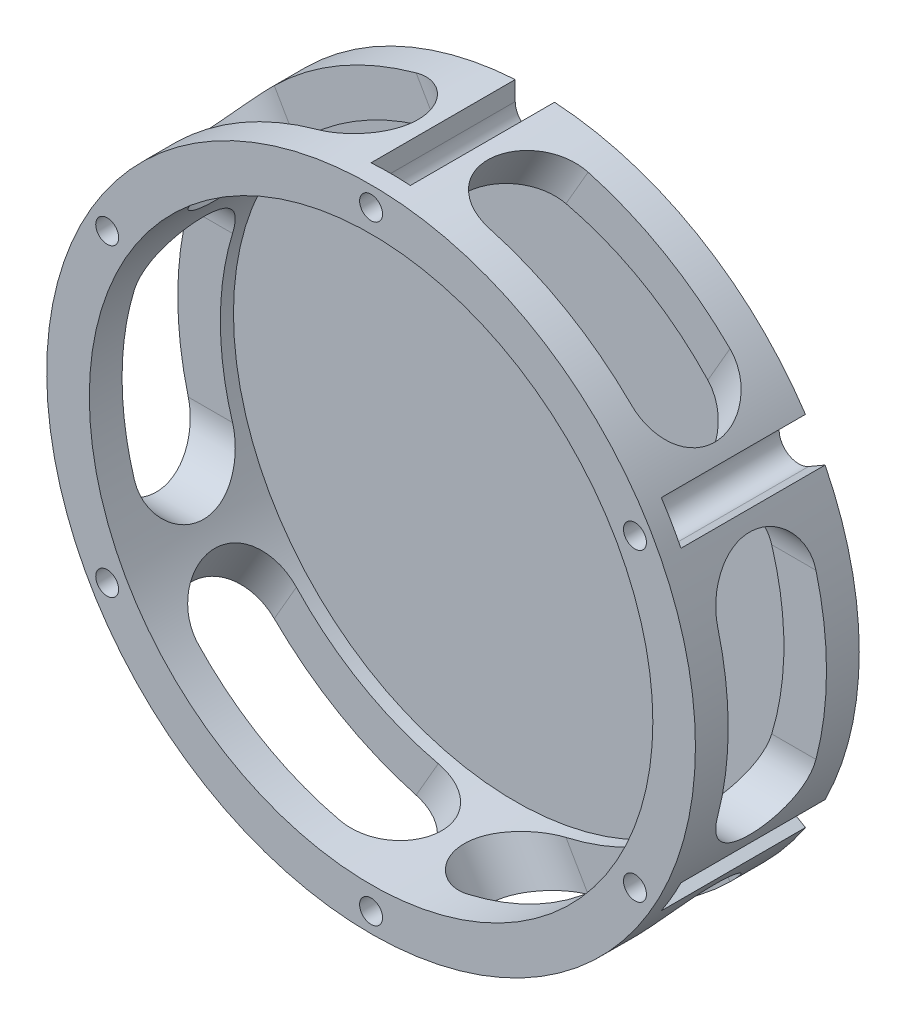
from build123d import *

# Parameters (mm, degrees)
SKETCH_1_R               = 49.5
SKETCH_1_R_2             = 43
SKETCH_1_R_3             = 1.75
EXTRUDE_1_DEPTH          = 25
CUT_EXTRUDE_1_DEPTH      = 59
PATTERN_CIRCULAR_1_COUNT = 6
SKETCH_3_R               = 44.045845484
EXTRUDE_2_DEPTH          = 3
CUT_EXTRUDE_3_DEPTH      = 22


with BuildPart() as part:
    # Эскиз1 → Бобышка-Вытянуть1 (new body)
    with BuildSketch(Plane.XY):
        Circle(SKETCH_1_R)
        Circle(SKETCH_1_R_2, mode=Mode.SUBTRACT)
        with Locations((0, 46.5)):
            Circle(SKETCH_1_R_3, mode=Mode.SUBTRACT)
        with Locations((40.270181276, 23.25)):
            Circle(SKETCH_1_R_3, mode=Mode.SUBTRACT)
        with Locations((40.270181276, -23.25)):
            Circle(SKETCH_1_R_3, mode=Mode.SUBTRACT)
        with Locations((0, -46.5)):
            Circle(SKETCH_1_R_3, mode=Mode.SUBTRACT)
        with Locations((-40.270181276, -23.25)):
            Circle(SKETCH_1_R_3, mode=Mode.SUBTRACT)
        with Locations((-40.270181276, 23.25)):
            Circle(SKETCH_1_R_3, mode=Mode.SUBTRACT)
    extrude(amount=EXTRUDE_1_DEPTH)

    # Эскиз2 → Вырез-Вытянуть1 (cut)
    with BuildSketch(Plane(origin=(0, 0, 0), x_dir=(0, 0, -1), z_dir=(1, 0, 0))):
        with BuildLine():
            Line((-5, 12.5), (-5, -12.5))
            ThreePointArc((-5, -12.5), (-12.5, -20), (-20, -12.5))
            Line((-20, -12.5), (-20, 12.5))
            ThreePointArc((-20, 12.5), (-12.5, 20), (-5, 12.5))
        make_face()
    cut_extrude_1 = extrude(amount=-CUT_EXTRUDE_1_DEPTH, mode=Mode.SUBTRACT)

    # Круговой массив1: Вырез-Вытянуть1 ×6 about axis
    pattern_circular_1_axis = Axis((0, 0, 25), (0, 0, -1))
    for i in range(1, PATTERN_CIRCULAR_1_COUNT):
        add(cut_extrude_1.rotate(pattern_circular_1_axis, i * 360 / PATTERN_CIRCULAR_1_COUNT), mode=Mode.SUBTRACT)

    # Эскиз3 → Бобышка-Вытянуть2 (add)
    with BuildSketch(Plane(origin=(0, 0, 0), x_dir=(-1, 0, 0), z_dir=(0, 0, -1))):
        Circle(SKETCH_3_R)
    extrude(amount=-EXTRUDE_2_DEPTH)

    # Эскиз4 → Вырез-Вытянуть3 (cut)
    with BuildSketch(Plane(origin=(0, 0, 0), x_dir=(-1, 0, 0), z_dir=(0, 0, -1))):
        with BuildLine():
            Line((-3, 46.5), (-3, 53.502718932))
            ThreePointArc((-3, 53.502718932), (0, 56.502718932), (3, 53.502718932))
            Line((3, 53.502718932), (3, 46.5))
            ThreePointArc((3, 46.5), (0, 43.5), (-3, 46.5))
        make_face()
        with BuildLine():
            Line((-41.770181276, 20.651923789), (-47.834713767, 24.153283255))
            ThreePointArc((-47.834713767, 24.153283255), (-48.932789978, 28.251359466), (-44.834713767, 29.349435677))
            Line((-44.834713767, 29.349435677), (-38.770181276, 25.848076211))
            ThreePointArc((-38.770181276, 25.848076211), (-37.672105065, 21.75), (-41.770181276, 20.651923789))
        make_face()
        with BuildLine():
            Line((-38.770181276, -25.848076211), (-44.834713767, -29.349435677))
            ThreePointArc((-44.834713767, -29.349435677), (-48.932789978, -28.251359466), (-47.834713767, -24.153283255))
            Line((-47.834713767, -24.153283255), (-41.770181276, -20.651923789))
            ThreePointArc((-41.770181276, -20.651923789), (-37.672105065, -21.75), (-38.770181276, -25.848076211))
        make_face()
        with BuildLine():
            Line((3, -46.5), (3, -53.502718932))
            ThreePointArc((3, -53.502718932), (0, -56.502718932), (-3, -53.502718932))
            Line((-3, -53.502718932), (-3, -46.5))
            ThreePointArc((-3, -46.5), (0, -43.5), (3, -46.5))
        make_face()
        with BuildLine():
            Line((41.770181276, -20.651923789), (47.834713767, -24.153283255))
            ThreePointArc((47.834713767, -24.153283255), (48.932789978, -28.251359466), (44.834713767, -29.349435677))
            Line((44.834713767, -29.349435677), (38.770181276, -25.848076211))
            ThreePointArc((38.770181276, -25.848076211), (37.672105065, -21.75), (41.770181276, -20.651923789))
        make_face()
        with BuildLine():
            Line((38.770181276, 25.848076211), (44.834713767, 29.349435677))
            ThreePointArc((44.834713767, 29.349435677), (48.932789978, 28.251359466), (47.834713767, 24.153283255))
            Line((47.834713767, 24.153283255), (41.770181276, 20.651923789))
            ThreePointArc((41.770181276, 20.651923789), (37.672105065, 21.75), (38.770181276, 25.848076211))
        make_face()
    extrude(amount=-CUT_EXTRUDE_3_DEPTH, mode=Mode.SUBTRACT)


solid = part.part
